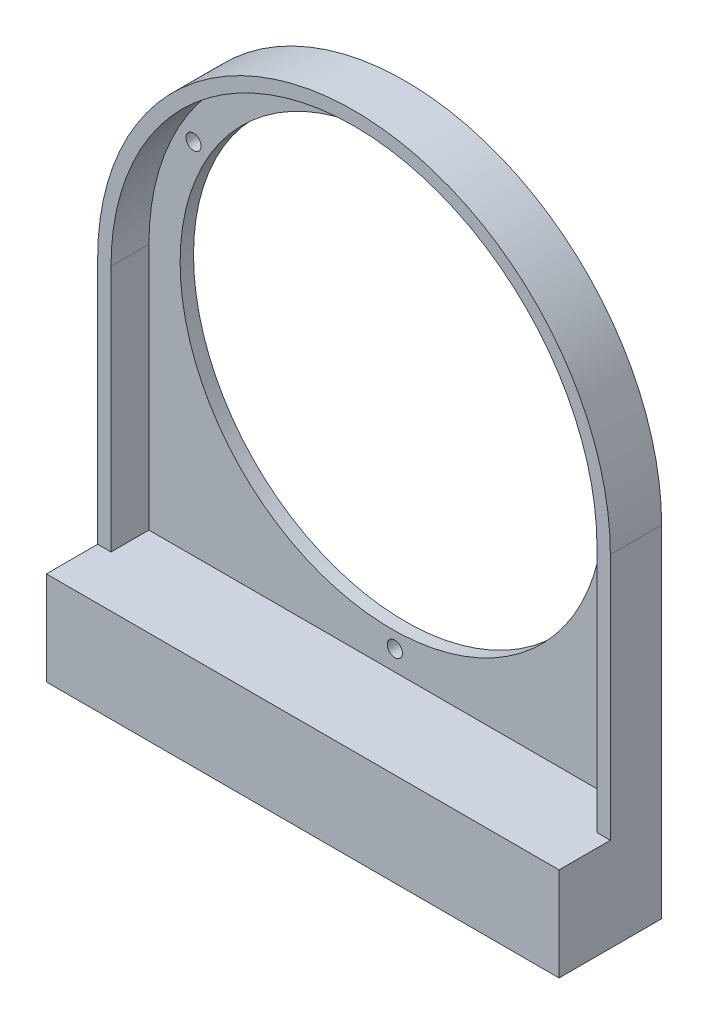
from build123d import *

# Parameters (mm, degrees)
BOSS_EXTRU_1_DEPTH      = 11.5
ESQUISSE2_W             = 115
ESQUISSE2_H             = 21
BOSS_EXTRU_2_DEPTH      = 11.5
ENL_V_MAT_EXTRU_1_DEPTH = 8.5
ESQUISSE4_R             = 47.5
ENL_V_MAT_EXTRU_2_DEPTH = 148.618596389
D_GAGEMENT_M31_D        = 3.4


with BuildPart() as part:
    # Esquisse1 → Boss.-Extru.1 (new body)
    with BuildSketch(Plane.XY):
        with BuildLine():
            Line((57.5, 0), (-57.5, 0))
            Line((-57.5, 0), (-57.5, 76.5))
            ThreePointArc((-57.5, 76.5), (0, 134), (57.5, 76.5))
            Line((57.5, 76.5), (57.5, 0))
        make_face()
    extrude(amount=BOSS_EXTRU_1_DEPTH)

    # Esquisse2 → Boss.-Extru.2 (add)
    with BuildSketch(Plane.XY.offset(11.5)):
        with Locations((0, 10.5)):
            Rectangle(ESQUISSE2_W, ESQUISSE2_H)
    extrude(amount=BOSS_EXTRU_2_DEPTH)

    # Esquisse3 → Enlèv. mat.-Extru.1 (cut)
    with BuildSketch(Plane.XY.offset(11.5)):
        with BuildLine():
            Line((-54.5, 21), (-54.5, 76.5))
            ThreePointArc((-54.5, 76.5), (0, 131), (54.5, 76.5))
            Line((54.5, 76.5), (54.5, 21))
            Line((54.5, 21), (-54.5, 21))
        make_face()
    extrude(amount=-ENL_V_MAT_EXTRU_1_DEPTH, mode=Mode.SUBTRACT)

    # Esquisse4 → Enlèv. mat.-Extru.2 (cut, through all)
    with BuildSketch(Plane(origin=(0, 0, 0), x_dir=(-1, 0, 0), z_dir=(0, 0, -1))):
        with Locations((0, 76.5)):
            Circle(ESQUISSE4_R)
    extrude(amount=-ENL_V_MAT_EXTRU_2_DEPTH, mode=Mode.SUBTRACT)

    # Dégagement M31 (through all)
    with Locations(Plane(origin=(0, 0, 0), x_dir=(-1, 0, 0), z_dir=(0, 0, -1))):
        with Locations((-43.835096885, 102.566919286), (44.492162743, 101.428847837), (-0.657065858, 25.504232877)):
            Hole(D_GAGEMENT_M31_D / 2)


solid = part.part
